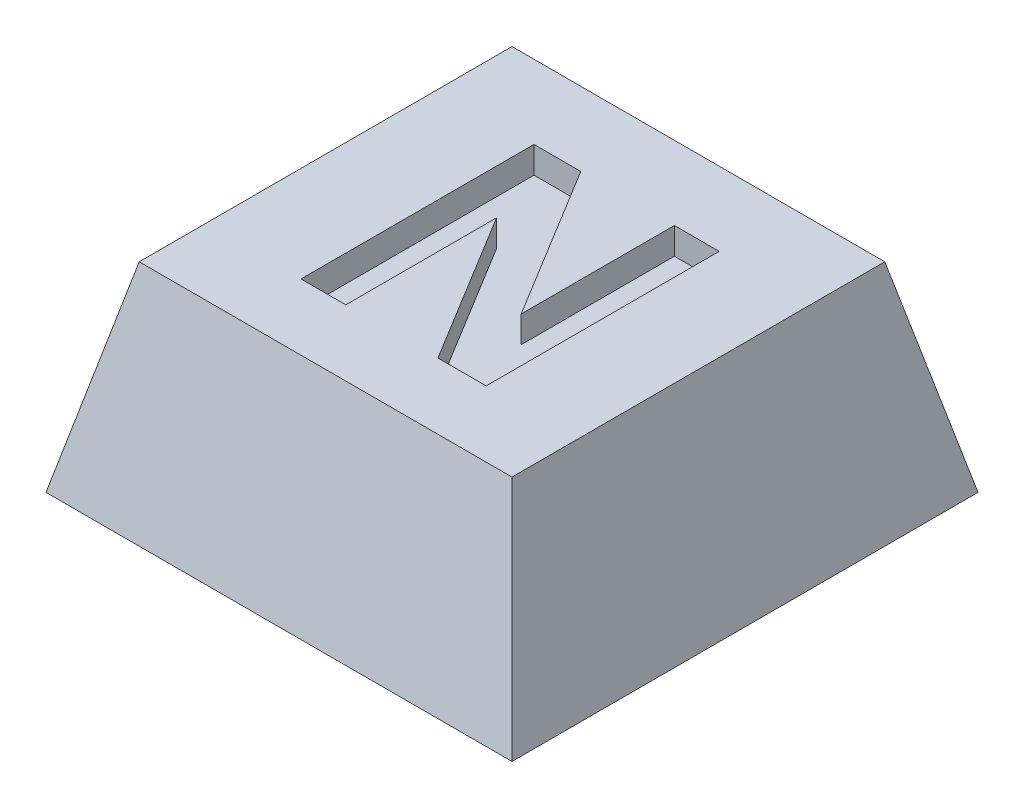
from build123d import *

# Parameters (mm, degrees)
SKETCH1_W           = 7
SKETCH1_H           = 7
BOSS_EXTRUDE1_DEPTH = 3
CUT_EXTRUDE1_DEPTH  = 7
CUT_EXTRUDE2_DEPTH  = 11
SKETCH4_R           = 1.8
CUT_EXTRUDE3_DEPTH  = 0.8
CUT_EXTRUDE4_DEPTH  = 0.4


with BuildPart() as part:
    # Sketch1 → Boss-Extrude1 (new body)
    with BuildSketch(Plane(origin=(0, 0, 0), x_dir=(1, 0, 0), z_dir=(0, 1, 0))):
        with Locations((3.5, 3.5)):
            Rectangle(SKETCH1_W, SKETCH1_H)
    extrude(amount=BOSS_EXTRUDE1_DEPTH)

    # Sketch2 → Cut-Extrude1 (cut)
    with BuildSketch(Plane.XY):
        Polygon((0, 0), (0.7, 3), (0, 3), align=None)
        Polygon((7, 0), (6.3, 3), (7, 3), align=None)
    extrude(amount=-CUT_EXTRUDE1_DEPTH, mode=Mode.SUBTRACT)

    # Sketch3 → Cut-Extrude2 (cut)
    with BuildSketch(Plane(origin=(0, 0, 0), x_dir=(0, 0, -1), z_dir=(1, 0, 0))):
        Polygon((0, 0), (0.7, 3), (0, 3), align=None)
        Polygon((7, 3), (6.3, 3), (7, 0), align=None)
    extrude(amount=CUT_EXTRUDE2_DEPTH, mode=Mode.SUBTRACT)

    # Sketch4 → Cut-Extrude3 (cut)
    with BuildSketch(Plane.XZ):
        with Locations(Location((3.5, -3.5, 0), (0, 0, 270))):
            Circle(SKETCH4_R)
    extrude(amount=-CUT_EXTRUDE3_DEPTH, mode=Mode.SUBTRACT)

    # Sketch5 → Cut-Extrude4 (cut)
    with BuildSketch(Plane(origin=(0, 3, 0), x_dir=(1, 0, 0), z_dir=(0, 1, 0))):
        Polygon((2.138497613, 1.691812675), (2.138497613, 5.191812675), (2.841722774, 5.191812675), (4.247471972, 2.890730944), (4.247471972, 5.191812675), (4.920548895, 5.191812675), (4.920548895, 1.691812675), (4.19558896, 1.691812675), (2.811574536, 3.956436073), (2.811574536, 1.691812675), align=None)
    extrude(amount=-CUT_EXTRUDE4_DEPTH, mode=Mode.SUBTRACT)


solid = part.part
